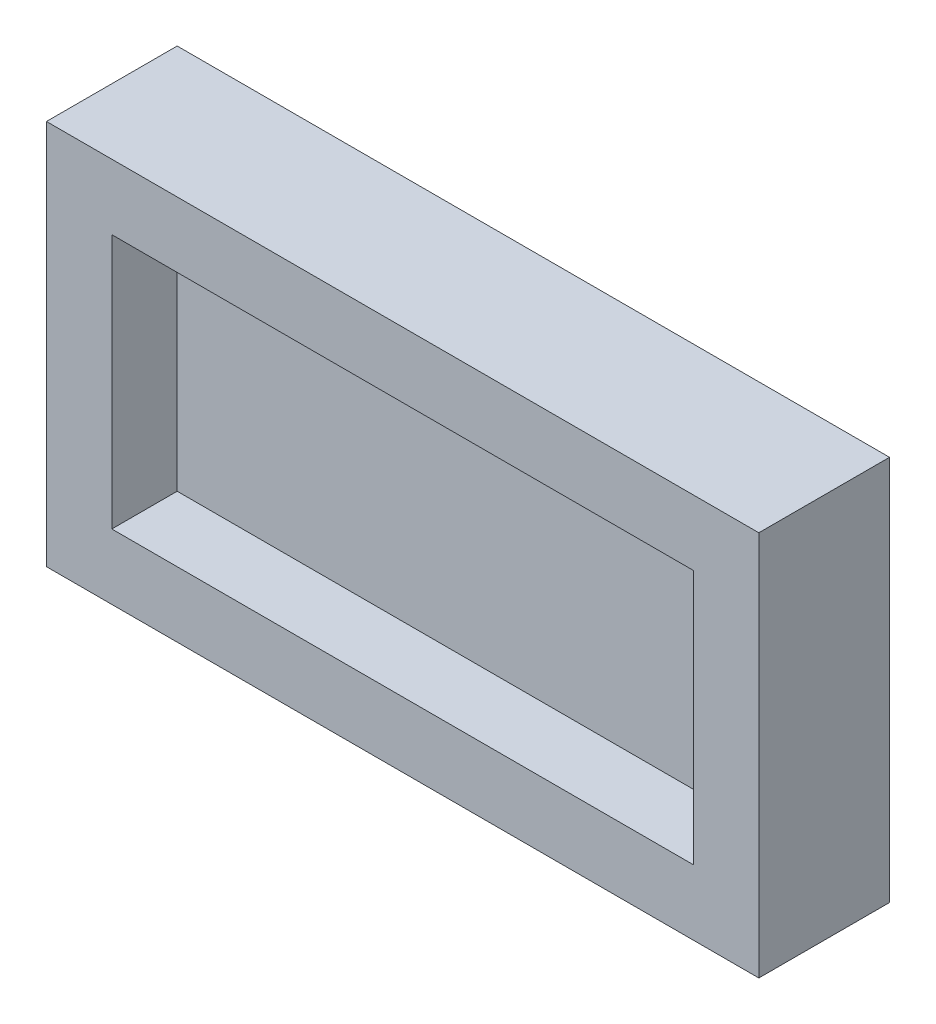
from build123d import *

# Parameters (mm, degrees)
SKETCH1_W           = 109
SKETCH1_H           = 59
SKETCH1_W_2         = 89
SKETCH1_H_2         = 39
BOSS_EXTRUDE1_DEPTH = 10
SKETCH2_W           = 109
SKETCH2_H           = 59
BOSS_EXTRUDE2_DEPTH = 10
SKETCH3_R           = 10.093684064
BOSS_EXTRUDE3_DEPTH = 10


with BuildPart() as part:
    # Sketch1 → Boss-Extrude1 (new body)
    with BuildSketch(Plane.XY):
        with Locations((54.5, -29.5)):
            Rectangle(SKETCH1_W, SKETCH1_H)
        with Locations((54.5, -29.5)):
            Rectangle(SKETCH1_W_2, SKETCH1_H_2, mode=Mode.SUBTRACT)
    extrude(amount=BOSS_EXTRUDE1_DEPTH)

    # Sketch2 → Boss-Extrude2 (add)
    with BuildSketch(Plane(origin=(0, 0, 0), x_dir=(-1, 0, 0), z_dir=(0, 0, -1))):
        with Locations((-54.5, -29.5)):
            Rectangle(SKETCH2_W, SKETCH2_H)
    extrude(amount=BOSS_EXTRUDE2_DEPTH)

    # Sketch3 → Boss-Extrude3 (add)
    with BuildSketch(Plane(origin=(0, 0, -10), x_dir=(-1, 0, 0), z_dir=(0, 0, -1))):
        with Locations((-54.5, -29.5)):
            Circle(SKETCH3_R)
    extrude(amount=BOSS_EXTRUDE3_DEPTH)


solid = part.part
